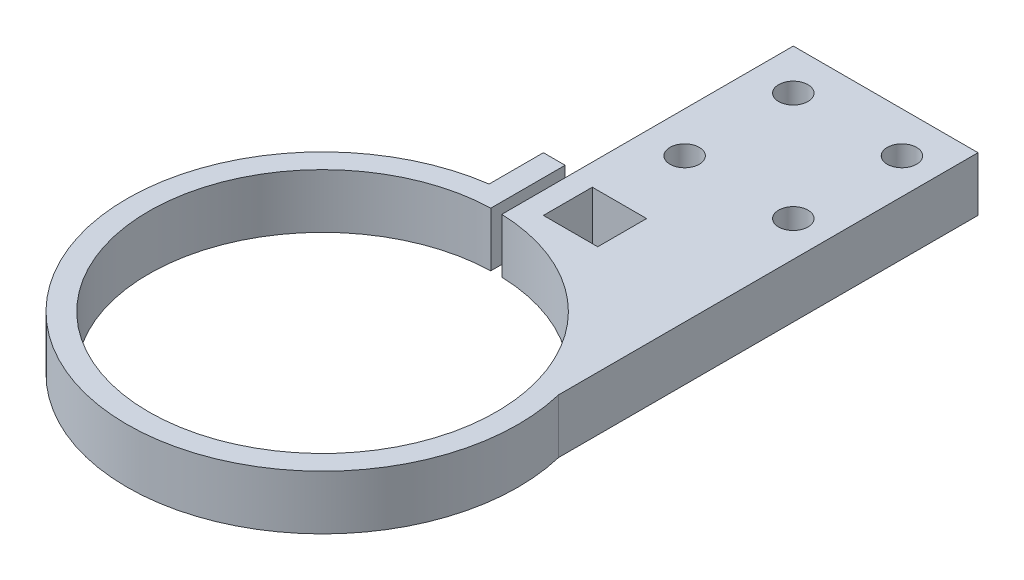
from build123d import *

# Parameters (mm, degrees)
SKETCH1_R           = 45.72
SKETCH1_R_2         = 40.64
BOSS_EXTRUDE1_DEPTH = 12.7
SKETCH2_W           = 12.7
SKETCH2_H           = 12.7
BOSS_EXTRUDE2_DEPTH = 12.7
SKETCH4_W           = 2.54
SKETCH4_H           = 20.630054542
CUT_EXTRUDE2_DEPTH  = 75.919470517
BOSS_EXTRUDE3_REACH = 119.055
BOSS_EXTRUDE3_START = 38.1
SKETCH5_W           = 57.976880414
SKETCH5_H           = 12.7
SKETCH6_W           = 43.18
SKETCH6_H           = 50.8
BOSS_EXTRUDE4_DEPTH = 12.7
SKETCH7_R           = 3.429
SKETCH7_W           = 12.7
SKETCH7_H           = 11.43
CUT_EXTRUDE3_DEPTH  = 119.676105904


with BuildPart() as part:
    # Sketch1 → Boss-Extrude1 (new body)
    with BuildSketch(Plane(origin=(0, 0, 0), x_dir=(1, 0, 0), z_dir=(0, 1, 0))):
        with Locations(Location((0, 0, 0), (0, 0, 270))):
            Circle(SKETCH1_R)
        with Locations(Location((0, 0, 0), (0, 0, 270))):
            Circle(SKETCH1_R_2, mode=Mode.SUBTRACT)
    extrude(amount=BOSS_EXTRUDE1_DEPTH)

    # Sketch2 → Boss-Extrude2 (add)
    with BuildSketch(Plane(origin=(0, 0, 0), x_dir=(1, 0, 0), z_dir=(0, 1, 0))):
        with Locations((0, 51.626880414)):
            Rectangle(SKETCH2_W, SKETCH2_H)
    extrude(amount=BOSS_EXTRUDE2_DEPTH)

    # Sketch4 → Cut-Extrude2 (cut, through all)
    with BuildSketch(Plane(origin=(0, 0, 0), x_dir=(1, 0, 0), z_dir=(0, 1, 0))):
        with Locations((0, 50.104960897)):
            Rectangle(SKETCH4_W, SKETCH4_H)
    extrude(amount=CUT_EXTRUDE2_DEPTH, mode=Mode.SUBTRACT)

    # Sketch5 → Boss-Extrude3 (add, up to next)
    with BuildSketch(Plane(origin=(6.35, 0, 0), x_dir=(0, 0, -1), z_dir=(1, 0, 0)).offset(BOSS_EXTRUDE3_START), mode=Mode.PRIVATE) as boss_extrude3_sk1:
        with Locations((28.988440207, 6.35)):
            Rectangle(SKETCH5_W, SKETCH5_H)
    boss_extrude3_tool1 = extrude(boss_extrude3_sk1.sketch, amount=-BOSS_EXTRUDE3_REACH, mode=Mode.PRIVATE) - part.part
    add(boss_extrude3_tool1.solids().sort_by_distance((44.45, 6.35, -28.98844))[0])

    # Sketch6 → Boss-Extrude4 (add)
    with BuildSketch(Plane(origin=(0, 12.7, 0), x_dir=(1, 0, 0), z_dir=(0, 1, 0))):
        with Locations((22.86, 83.376880414)):
            Rectangle(SKETCH6_W, SKETCH6_H)
    extrude(amount=-BOSS_EXTRUDE4_DEPTH)

    # Sketch7 → Cut-Extrude3 (cut, through all)
    with BuildSketch(Plane(origin=(0, 0, 0), x_dir=(1, 0, 0), z_dir=(0, 1, 0))):
        with Locations(Location((10.795, 99.251880414, 0), (0, 0, 270))):
            Circle(SKETCH7_R)
        with Locations(Location((36.195, 99.251880414, 0), (0, 0, 270))):
            Circle(SKETCH7_R)
        with Locations(Location((36.195, 73.851880414, 0), (0, 0, 270))):
            Circle(SKETCH7_R)
        with Locations(Location((10.795, 73.851880414, 0), (0, 0, 270))):
            Circle(SKETCH7_R)
        with Locations((12.7, 50.991880414)):
            Rectangle(SKETCH7_W, SKETCH7_H)
    extrude(amount=CUT_EXTRUDE3_DEPTH, mode=Mode.SUBTRACT)


solid = part.part
